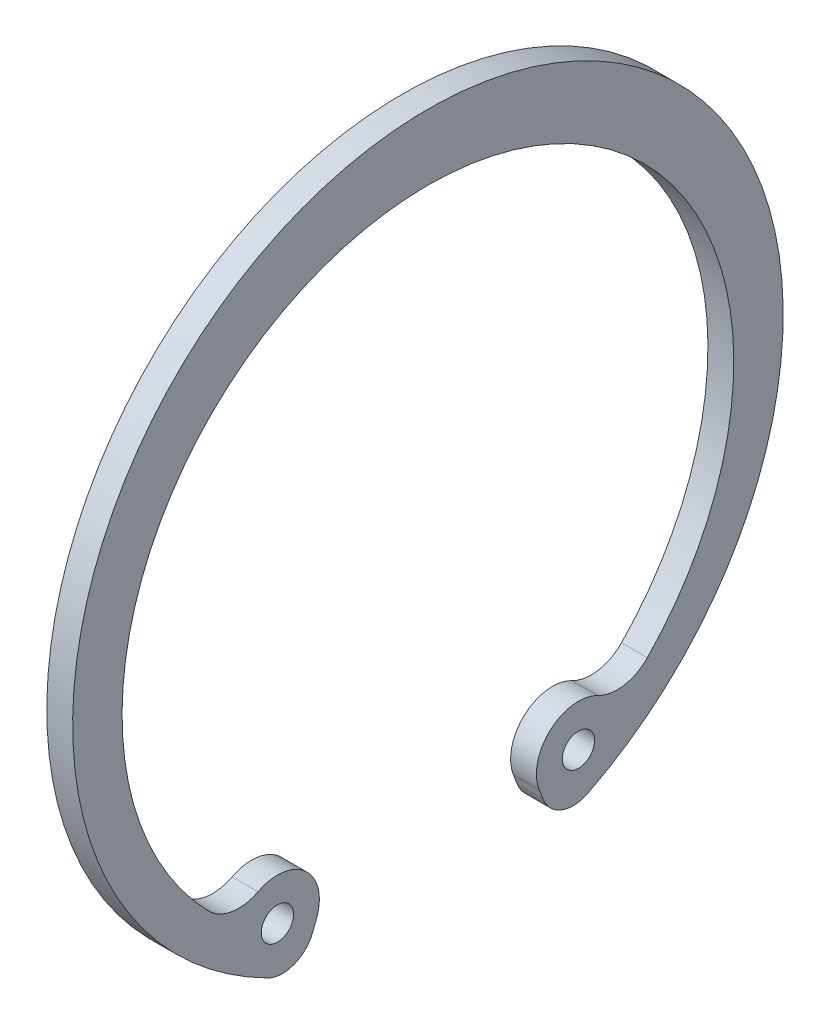
from build123d import *

# Parameters (mm, degrees)
BOSS_EXTRUDE1_DEPTH      = 1
BOSS_EXTRUDE1_DEPTH_BACK = 1
SKETCH1_R                = 1.25


with BuildPart() as part:
    # Sketch1 → Boss-Extrude1 (new, two sides: drawn at the far end of the back side and taken through both)
    with BuildSketch(Plane(origin=(0, 0, 0), x_dir=(0, 0, -1), z_dir=(1, 0, 0)).offset(-BOSS_EXTRUDE1_DEPTH_BACK)):
        with BuildLine():
            Line((-8.918483886, -23.220909654), (-8.616074, -22.433530013))
            ThreePointArc((-8.616074, -22.433530013), (-9.486095569, -18.843411487), (-13.151705182, -18.38603339))
            ThreePointArc((-13.151705182, -18.38603339), (-15.170840028, -18.712326304), (-16.985042177, -17.767845941))
            ThreePointArc((-16.985042177, -17.767845941), (-1.98e-07, 22.4), (16.985042454, -17.767845656))
            ThreePointArc((16.985042454, -17.767845656), (15.170840224, -18.712326272), (13.151705182, -18.38603339))
            ThreePointArc((13.151705182, -18.38603339), (9.486095569, -18.843411487), (8.616074, -22.433530013))
            Line((8.616074, -22.433530013), (8.918483886, -23.220909654))
            ThreePointArc((8.918483886, -23.220909654), (10.351464338, -24.65663681), (12.377500601, -24.557025041))
            ThreePointArc((12.377500601, -24.557025041), (-9.7e-08, 27.5), (-12.377500429, -24.557025128))
            ThreePointArc((-12.377500429, -24.557025128), (-10.351464248, -24.656636775), (-8.918483886, -23.220909654))
        make_face()
        with Locations((11.65, -21.26828625)):
            Circle(SKETCH1_R, mode=Mode.SUBTRACT)
        with Locations((-11.65, -21.26828625)):
            Circle(SKETCH1_R, mode=Mode.SUBTRACT)
    extrude(amount=BOSS_EXTRUDE1_DEPTH + BOSS_EXTRUDE1_DEPTH_BACK)


solid = part.part
